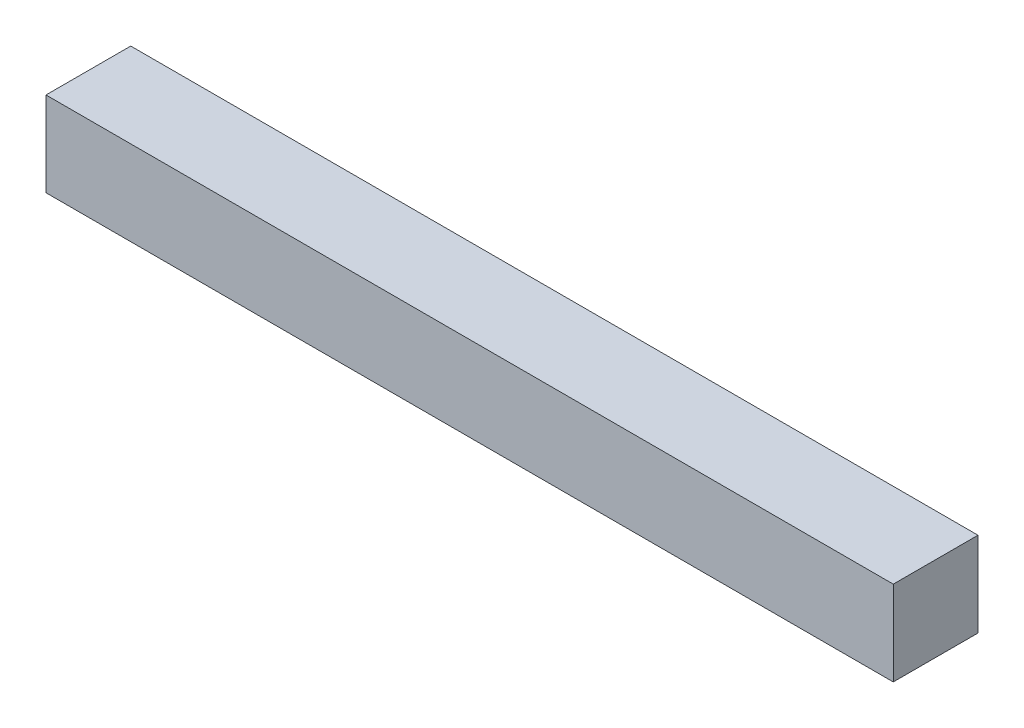
from build123d import *

# Parameters (mm, degrees)
STORE_EVAPORATOR_2_1_START = -650
SKETCH1_W                  = 1000
SKETCH1_H                  = 100
STORE_EVAPORATOR_2_1_DEPTH = 100


with BuildPart() as part:
    # Sketch1 → STORE_evaporator_2_1 (new body)
    with BuildSketch(Plane.XY.offset(STORE_EVAPORATOR_2_1_START)):
        with Locations((700, 550)):
            Rectangle(SKETCH1_W, SKETCH1_H)
    extrude(amount=-STORE_EVAPORATOR_2_1_DEPTH)


solid = part.part
